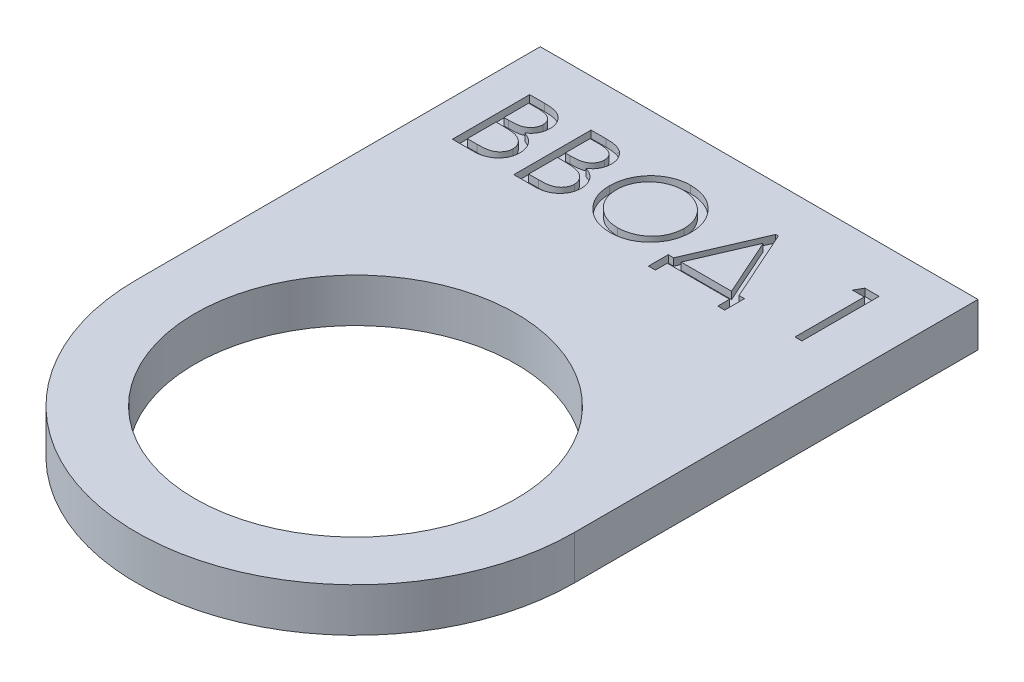
from build123d import *

# Parameters (mm, degrees)
SKETCH1_R           = 11
BOSS_EXTRUDE1_DEPTH = 1.5
CUT_EXTRUDE1_DEPTH  = 0.5


with BuildPart() as part:
    # Sketch1 → Boss-Extrude1 (new, symmetric)
    with BuildSketch(Plane(origin=(0, 0, 0), x_dir=(1, 0, 0), z_dir=(0, 1, 0))):
        with BuildLine():
            Line((15, 17.5), (-15, 17.5))
            Line((-15, 17.5), (-15, -10.16226942))
            ThreePointArc((-15, -10.16226942), (0, -25.16226942), (15, -10.16226942))
            Line((15, -10.16226942), (15, 17.5))
        make_face()
        with Locations(Location((0, -10.16226942, 0), (0, 0, 270))):
            Circle(SKETCH1_R, mode=Mode.SUBTRACT)
    extrude(amount=BOSS_EXTRUDE1_DEPTH, both=True)

    # Sketch2 → Cut-Extrude1 (cut)
    # profile 1 of 5: a face of its own
    with BuildSketch(Plane(origin=(0, 1.5, 0), x_dir=(1, 0, 0), z_dir=(0, 1, 0))):
        Polygon((10.45294972, 14.291666667), (11.431356838, 14.291666667), (11.431356838, 9), (10.956463675, 9), (10.956463675, 13.748931624), (10.142361111, 13.748931624), align=None)
    # profile 2 of 5: a face of its own
    with BuildSketch(Plane(origin=(0, 1.5, 0), x_dir=(1, 0, 0), z_dir=(0, 1, 0))):
        Polygon((2.204861111, 8.185897436), (1.729967949, 8.185897436), (1.729967949, 9.542735043), (2.103098291, 9.542735043), (4.211496728, 14.427350427), (4.393821782, 14.427350427), (6.580662393, 9.542735043), (6.953792735, 9.542735043), (6.953792735, 8.185897436), (6.478899573, 8.185897436), (6.478899573, 9), (2.204861111, 9), align=None)
        Polygon((2.612972423, 9.542735043), (6.067608173, 9.542735043), (4.307959402, 13.472263956), align=None, mode=Mode.SUBTRACT)
    # profile 3 of 5: a face of its own
    with BuildSketch(Plane(origin=(0, 1.5, 0), x_dir=(1, 0, 0), z_dir=(0, 1, 0))):
        with BuildLine():
            add(Edge.make_bspline(
                [(-1.628205128, 14.427350427), (-1.530221444, 14.424868667), (-1.337773405, 14.419994285), (-1.054933976, 14.38268183), (-0.784915201, 14.318130467), (-0.525517491, 14.232159053), (-0.279843586, 14.117474446), (-0.046044308, 13.978855234), (0.17532406, 13.81484916), (0.381277816, 13.626724019), (0.569747253, 13.42203713), (0.735793533, 13.20360029), (0.874952715, 12.972734244), (0.989231227, 12.73013275), (1.078885077, 12.476344465), (1.140750774, 12.210016389), (1.180269168, 11.932874132), (1.184889212, 11.74384542), (1.187232906, 11.647953392)],
                knots=[0, 0, 0, 0, 1.065120563, 2.091984664, 3.0946048, 4.079830382, 5.057816894, 6.036188127, 7.030412546, 8.04752943, 9.064399622, 10.05169764, 11.02544977, 11.989514704, 12.962713494, 13.945757189, 14.957906945, 16, 16, 16, 16], degree=3))
            add(Edge.make_bspline(
                [(1.187232906, 11.647953392), (1.184889556, 11.552767729), (1.180270541, 11.36514576), (1.140705841, 11.08976222), (1.078655758, 10.825041762), (0.990063784, 10.571426311), (0.876330025, 10.328648327), (0.73624423, 10.097346623), (0.571233114, 9.87744537), (0.383444185, 9.671353602), (0.178730705, 9.482369331), (-0.040843627, 9.317694364), (-0.270340671, 9.175992414), (-0.512713682, 9.062926621), (-0.764748261, 8.97255717), (-1.028700107, 8.910943074), (-1.303332397, 8.871199569), (-1.490613557, 8.86663586), (-1.585803953, 8.864316239)],
                knots=[0, 0, 0, 0, 1.043624062, 2.057103931, 3.04512605, 4.022047818, 4.998200453, 5.980619268, 6.982898556, 8.009068085, 9.034988726, 10.034168286, 11.015286542, 11.987931943, 12.962482838, 13.94673481, 14.956375938, 16, 16, 16, 16], degree=3))
            add(Edge.make_bspline(
                [(-1.585803953, 8.864316239), (-1.681695483, 8.866658765), (-1.870723214, 8.871276506), (-2.148213732, 8.910860296), (-2.414728892, 8.972759649), (-2.669506542, 9.061220344), (-2.912688757, 9.175546395), (-3.144751144, 9.314950635), (-3.364762236, 9.480363812), (-3.570897972, 9.668091848), (-3.759506878, 9.872458361), (-3.923940696, 10.091433961), (-4.063376284, 10.320722568), (-4.177318466, 10.560960491), (-4.267525446, 10.810986363), (-4.329067254, 11.07246799), (-4.368884706, 11.343914624), (-4.373473104, 11.528734244), (-4.375801282, 11.622512687)],
                knots=[0, 0, 0, 0, 1.053102029, 2.075944431, 3.073151272, 4.055350789, 5.033113405, 6.020478099, 7.024410459, 8.052272461, 9.079885166, 10.07527673, 11.055994387, 12.023226415, 12.992069828, 13.970394897, 14.97016774, 16, 16, 16, 16], degree=3))
            add(Edge.make_bspline(
                [(-4.375801282, 11.622512687), (-4.374992964, 11.685457318), (-4.373386525, 11.810552504), (-4.354046705, 11.996315102), (-4.32598318, 12.179090263), (-4.285763622, 12.358358244), (-4.233161935, 12.533680209), (-4.171095179, 12.706265291), (-4.095288508, 12.874364493), (-4.009592767, 13.038774144), (-3.913946938, 13.196931335), (-3.80830146, 13.346427848), (-3.696367033, 13.488518164), (-3.573655712, 13.619520182), (-3.444211801, 13.743244877), (-3.305935443, 13.85779089), (-3.159670384, 13.964191113), (-3.004787262, 14.060076629), (-2.845102489, 14.146798177), (-2.68049117, 14.221216928), (-2.513188973, 14.28508895), (-2.342412303, 14.336857817), (-2.168614659, 14.377727681), (-1.991416723, 14.405557846), (-1.810959662, 14.424946994), (-1.689385406, 14.426545836), (-1.628205128, 14.427350427)],
                knots=[0, 0, 0, 0, 1.037015668, 2.060948919, 3.074880161, 4.083647147, 5.086022904, 6.090072063, 7.104153813, 8.122640571, 9.144368836, 10.147691507, 11.138137339, 12.123020368, 13.103399296, 14.087645067, 15.080126199, 16.082011238, 17.087798457, 18.072939717, 19.057185487, 20.037253025, 21.01195951, 21.997135196, 22.992090687, 24, 24, 24, 24], degree=3))
        make_face()
        with BuildLine():
            add(Edge.make_bspline(
                [(-1.604884482, 13.884615385), (-1.655101844, 13.884003229), (-1.755056488, 13.88278477), (-1.903653347, 13.866734819), (-2.050295913, 13.843859868), (-2.195014473, 13.811230664), (-2.337203506, 13.766774537), (-2.478188384, 13.715610307), (-2.616683478, 13.653287943), (-2.752231572, 13.58287445), (-2.883638888, 13.504937391), (-3.007634282, 13.418801505), (-3.124538756, 13.326486786), (-3.234066076, 13.227777794), (-3.335894634, 13.122171848), (-3.432028647, 13.011269951), (-3.5186148, 12.891902211), (-3.597967993, 12.767305524), (-3.668978895, 12.637642181), (-3.732124133, 12.504277271), (-3.783776861, 12.366122911), (-3.82590212, 12.224677934), (-3.860826834, 12.080166359), (-3.882951934, 11.93149192), (-3.899178239, 11.779401692), (-3.900327053, 11.676619603), (-3.90090812, 11.624632746)],
                knots=[0, 0, 0, 0, 1.008559885, 2.007477868, 2.99961109, 3.989939068, 4.984837346, 5.991145699, 7.001802488, 8.033829008, 9.059044045, 10.069351652, 11.065060232, 12.050310815, 13.029377138, 14.011219647, 14.996725999, 15.989392538, 16.977580475, 17.965360261, 18.951710183, 19.937753436, 20.929683414, 21.935841486, 22.955955122, 24, 24, 24, 24], degree=3))
            add(Edge.make_bspline(
                [(-3.90090812, 11.624632746), (-3.89898065, 11.548187483), (-3.89518872, 11.397796003), (-3.861990965, 11.177408452), (-3.810855361, 10.965608305), (-3.735475772, 10.763554466), (-3.64120758, 10.569510134), (-3.524750258, 10.38519669), (-3.386775212, 10.21056432), (-3.230045833, 10.046832187), (-3.058712693, 9.897386745), (-2.876781065, 9.766208734), (-2.686200016, 9.655219428), (-2.486472555, 9.564799854), (-2.278664966, 9.493151084), (-2.061438192, 9.444046487), (-1.836239283, 9.411728834), (-1.682734602, 9.408625263), (-1.604884482, 9.407051282)],
                knots=[0, 0, 0, 0, 1.032063989, 2.030389145, 3.003944642, 3.970395727, 4.937377036, 5.913328081, 6.909231446, 7.93887556, 8.970685674, 9.976071282, 10.964166581, 11.944589148, 12.933237628, 13.927779006, 14.949070134, 16, 16, 16, 16], degree=3))
            add(Edge.make_bspline(
                [(-1.604884482, 9.407051282), (-1.552558212, 9.407770199), (-1.448779502, 9.409196028), (-1.294420795, 9.423557123), (-1.142842951, 9.446586259), (-0.994258576, 9.479743322), (-0.848836302, 9.521240884), (-0.705969159, 9.570540663), (-0.567178886, 9.632046768), (-0.430714608, 9.70000379), (-0.300091719, 9.777474029), (-0.175396569, 9.860686469), (-0.059772171, 9.952865217), (0.049673211, 10.050107624), (0.151919836, 10.154374394), (0.246276277, 10.265529968), (0.33242481, 10.384275961), (0.411747871, 10.508683658), (0.482509947, 10.638701802), (0.544164061, 10.772550244), (0.596470093, 10.909899397), (0.638695332, 11.050947368), (0.671784066, 11.195426271), (0.694583469, 11.343529556), (0.710531703, 11.494960942), (0.711733784, 11.597383201), (0.712339744, 11.649013421)],
                knots=[0, 0, 0, 0, 1.047197238, 2.076906641, 3.100256066, 4.114471768, 5.12198147, 6.126382909, 7.136867548, 8.15857795, 9.17633901, 10.174870724, 11.156907918, 12.133735059, 13.104061851, 14.077631395, 15.04955518, 16.038496417, 17.029181396, 18.010275684, 18.986308667, 19.968651475, 20.955262928, 21.950658345, 22.966943676, 24, 24, 24, 24], degree=3))
            add(Edge.make_bspline(
                [(0.712339744, 11.649013421), (0.711733299, 11.700290434), (0.710530304, 11.802007834), (0.694591087, 11.952383118), (0.671759979, 12.099420712), (0.638856837, 12.242543367), (0.596447676, 12.381787565), (0.544154926, 12.517022529), (0.482491438, 12.648752062), (0.41172186, 12.776650582), (0.332171746, 12.899379055), (0.245245926, 13.016706512), (0.149443555, 13.126429586), (0.047501826, 13.23125704), (-0.063125584, 13.328953135), (-0.181937552, 13.419550279), (-0.307491684, 13.505234872), (-0.44042929, 13.582531853), (-0.577625506, 13.653915276), (-0.718404942, 13.71507334), (-0.861172747, 13.767040711), (-1.00556587, 13.81136517), (-1.152799658, 13.843732073), (-1.301879257, 13.866755434), (-1.452598409, 13.882779184), (-1.553961373, 13.884001375), (-1.604884482, 13.884615385)],
                knots=[0, 0, 0, 0, 1.02996197, 2.043119294, 3.035359645, 4.018872909, 4.991431989, 5.957985074, 6.929999688, 7.912076566, 8.892894881, 9.867085534, 10.843653904, 11.817741046, 12.803660682, 13.806313499, 14.818574707, 15.856120519, 16.894564902, 17.924820532, 18.937903209, 19.946497019, 20.957711757, 21.963978472, 22.977135795, 24, 24, 24, 24], degree=3))
        make_face(mode=Mode.SUBTRACT)
    # profile 4 of 5: a face of its own
    with BuildSketch(Plane(origin=(0, 1.5, 0), x_dir=(1, 0, 0), z_dir=(0, 1, 0))):
        with BuildLine():
            Line((-8.310630342, 14.291666667), (-7.278161725, 14.291666667))
            add(Edge.make_bspline(
                [(-7.278161725, 14.291666667), (-7.22762105, 14.291400949), (-7.129660643, 14.290885921), (-6.98720982, 14.28289833), (-6.853786023, 14.272007068), (-6.729350558, 14.254725856), (-6.613960924, 14.233874002), (-6.507269377, 14.208622447), (-6.409615188, 14.178344115), (-6.293028075, 14.13019557), (-6.160100409, 14.058647447), (-6.016169506, 13.952922116), (-5.893094049, 13.823605178), (-5.786979022, 13.677732592), (-5.702613043, 13.517265413), (-5.64157851, 13.346028306), (-5.602937437, 13.166229958), (-5.598963495, 13.042793249), (-5.596955128, 12.980410323)],
                knots=[0, 0, 0, 0, 1.001505555, 1.941167018, 2.826882275, 3.653841531, 4.429895133, 5.150066043, 5.825578002, 6.45369114, 7.647487171, 8.808567382, 9.977351308, 11.170798116, 12.373658725, 13.556498008, 14.765093433, 16, 16, 16, 16], degree=3))
            add(Edge.make_bspline(
                [(-5.596955128, 12.980410323), (-5.59860797, 12.92197134), (-5.601855961, 12.807133228), (-5.632914657, 12.639169515), (-5.681538525, 12.479283743), (-5.749128604, 12.328059423), (-5.836973288, 12.188913365), (-5.941080508, 12.060723093), (-6.066684722, 11.948916138), (-6.160790572, 11.886409607), (-6.208592081, 11.854659121)],
                knots=[0, 0, 0, 0, 1.044552857, 2.05264487, 3.044412934, 4.028983338, 5.005914585, 5.980388656, 6.974128949, 8, 8, 8, 8], degree=3))
            add(Edge.make_bspline(
                [(-6.208592081, 11.854659121), (-6.148478101, 11.831579897), (-6.033465166, 11.787423623), (-5.875189885, 11.709355719), (-5.73882387, 11.624443957), (-5.623318661, 11.531716041), (-5.524534349, 11.431765815), (-5.438275735, 11.323127725), (-5.364674134, 11.204384603), (-5.301608166, 11.076774496), (-5.252397547, 10.941600431), (-5.215543501, 10.800130329), (-5.194426048, 10.652871478), (-5.191420924, 10.552654297), (-5.189903846, 10.502061632)],
                knots=[0, 0, 0, 0, 1.27268992, 2.434971085, 3.483601985, 4.442670788, 5.356604649, 6.2567628, 7.179492994, 8.113709626, 9.066344395, 10.018646069, 10.999752585, 12, 12, 12, 12], degree=3))
            add(Edge.make_bspline(
                [(-5.189903846, 10.502061632), (-5.191380744, 10.450404575), (-5.194286583, 10.348767869), (-5.21572535, 10.199459511), (-5.252024833, 10.05677358), (-5.302025257, 9.919787173), (-5.367282566, 9.788765303), (-5.446699845, 9.663559534), (-5.541392804, 9.545427868), (-5.647321189, 9.433057628), (-5.767158005, 9.332020378), (-5.896449682, 9.242038298), (-6.036824475, 9.168036514), (-6.185976894, 9.105873005), (-6.345580087, 9.058388312), (-6.514917362, 9.025167873), (-6.693842676, 9.002784067), (-6.816624085, 9.000943769), (-6.879590678, 9)],
                knots=[0, 0, 0, 0, 0.978564426, 1.925352924, 2.850884081, 3.763762016, 4.682927383, 5.618979971, 6.567305752, 7.547517671, 8.540179244, 9.531824382, 10.526200242, 11.540722885, 12.589160233, 13.674978461, 14.80764778, 16, 16, 16, 16], degree=3))
            Line((-6.879590678, 9), (-8.310630342, 9))
            Line((-8.310630342, 9), (-8.310630342, 14.291666667))
        make_face()
        with BuildLine():
            Line((-7.835737179, 13.748931624), (-7.835737179, 12.052884615))
            Line((-7.835737179, 12.052884615), (-7.516668336, 12.052884615))
            add(Edge.make_bspline(
                [(-7.516668336, 12.052884615), (-7.470027895, 12.053489261), (-7.379909059, 12.054657559), (-7.249401597, 12.058004186), (-7.1282602, 12.067375038), (-7.016693976, 12.076743196), (-6.914878615, 12.091975013), (-6.823039681, 12.11010596), (-6.73973585, 12.129281305), (-6.643670109, 12.161892315), (-6.534702675, 12.210088324), (-6.418538339, 12.284885029), (-6.316130271, 12.373973039), (-6.229653571, 12.476768898), (-6.158879086, 12.58995944), (-6.109721445, 12.711738653), (-6.076388051, 12.839071471), (-6.073377045, 12.926487163), (-6.071848291, 12.970870059)],
                knots=[0, 0, 0, 0, 1.156816544, 2.235205308, 3.236616184, 4.169592532, 5.011045266, 5.787822928, 6.49130361, 7.128639758, 8.301311294, 9.436451833, 10.541879658, 11.654887649, 12.756523258, 13.837046038, 14.901820046, 16, 16, 16, 16], degree=3))
            add(Edge.make_bspline(
                [(-6.071848291, 12.970870059), (-6.072643825, 13.000239975), (-6.074204352, 13.057852274), (-6.086984941, 13.141837607), (-6.108707345, 13.220825185), (-6.136608479, 13.295897471), (-6.17559852, 13.364707054), (-6.221505185, 13.429633076), (-6.276970455, 13.488464493), (-6.340103535, 13.543451711), (-6.412688, 13.592202366), (-6.494680548, 13.63489971), (-6.587190489, 13.669281599), (-6.688658734, 13.699392924), (-6.800647164, 13.720541893), (-6.921863453, 13.738160705), (-7.053300468, 13.747130446), (-7.144234135, 13.74831784), (-7.191239316, 13.748931624)],
                knots=[0, 0, 0, 0, 0.91205012, 1.789085906, 2.630437955, 3.453916878, 4.269457761, 5.079663411, 5.91843418, 6.774407191, 7.675494373, 8.627863946, 9.638891023, 10.736472738, 11.911756761, 13.175263542, 14.539845004, 16, 16, 16, 16], degree=3))
            Line((-7.191239316, 13.748931624), (-7.835737179, 13.748931624))
        make_face(mode=Mode.SUBTRACT)
        with BuildLine():
            Line((-7.835737179, 11.510149573), (-7.835737179, 9.542735043))
            Line((-7.835737179, 9.542735043), (-7.159438435, 9.542735043))
            add(Edge.make_bspline(
                [(-7.159438435, 9.542735043), (-7.111028868, 9.543315232), (-7.017725811, 9.544433471), (-6.883013237, 9.548084048), (-6.758155449, 9.556387845), (-6.643722196, 9.569459547), (-6.538477821, 9.583638869), (-6.443684865, 9.602705924), (-6.358574918, 9.624551377), (-6.259886381, 9.658318518), (-6.148756077, 9.710776277), (-6.028996806, 9.789870406), (-5.922519072, 9.884097311), (-5.832099215, 9.993152384), (-5.757996245, 10.111733081), (-5.704088592, 10.237440931), (-5.670840511, 10.368198812), (-5.666815565, 10.457350865), (-5.664797009, 10.502061632)],
                knots=[0, 0, 0, 0, 1.160039823, 2.235823828, 3.228722157, 4.157150951, 4.99529583, 5.772374946, 6.472645482, 7.099169577, 8.269452708, 9.405989375, 10.527446681, 11.663510218, 12.788923519, 13.866172445, 14.929861265, 16, 16, 16, 16], degree=3))
            add(Edge.make_bspline(
                [(-5.664797009, 10.502061632), (-5.665214452, 10.530021802), (-5.666042606, 10.585491141), (-5.678531869, 10.667006724), (-5.696695696, 10.745967271), (-5.720177744, 10.822587188), (-5.754376224, 10.895481221), (-5.794300406, 10.966091044), (-5.841111096, 11.034509995), (-5.91405168, 11.121009473), (-6.020145038, 11.220669719), (-6.170892186, 11.318244276), (-6.342300304, 11.396935603), (-6.466620442, 11.430347907), (-6.530841012, 11.447607839)],
                knots=[0, 0, 0, 0, 0.723448775, 1.435228256, 2.130040452, 2.821711965, 3.505591119, 4.210454504, 4.921174351, 5.648778258, 7.137944449, 8.670945889, 10.280296675, 12, 12, 12, 12], degree=3))
            add(Edge.make_bspline(
                [(-6.530841012, 11.447607839), (-6.556587383, 11.452831597), (-6.612410827, 11.464157782), (-6.703438954, 11.476113476), (-6.807361042, 11.486764936), (-6.924417058, 11.49464371), (-7.054755104, 11.502787651), (-7.19865354, 11.505954821), (-7.355524719, 11.509733464), (-7.464370329, 11.510007322), (-7.520908454, 11.510149573)],
                knots=[0, 0, 0, 0, 0.634451884, 1.375622551, 2.216452059, 3.157844607, 4.20941857, 5.370758133, 6.634282058, 8, 8, 8, 8], degree=3))
            Line((-7.520908454, 11.510149573), (-7.835737179, 11.510149573))
        make_face(mode=Mode.SUBTRACT)
    # profile 5 of 5: a face of its own
    with BuildSketch(Plane(origin=(0, 1.5, 0), x_dir=(1, 0, 0), z_dir=(0, 1, 0))):
        with BuildLine():
            Line((-12.516826923, 14.291666667), (-11.484358307, 14.291666667))
            add(Edge.make_bspline(
                [(-11.484358307, 14.291666667), (-11.433817631, 14.291400949), (-11.335857224, 14.290885921), (-11.193406401, 14.28289833), (-11.059982604, 14.272007068), (-10.935547139, 14.254725856), (-10.820157505, 14.233874002), (-10.713465959, 14.208622447), (-10.61581177, 14.178344115), (-10.499224656, 14.13019557), (-10.36629699, 14.058647447), (-10.222366087, 13.952922116), (-10.09929063, 13.823605178), (-9.993175603, 13.677732592), (-9.908809624, 13.517265413), (-9.847775091, 13.346028306), (-9.809134018, 13.166229958), (-9.805160076, 13.042793249), (-9.803151709, 12.980410323)],
                knots=[0, 0, 0, 0, 1.001505555, 1.941167018, 2.826882275, 3.653841531, 4.429895133, 5.150066043, 5.825578002, 6.45369114, 7.647487171, 8.808567382, 9.977351308, 11.170798116, 12.373658725, 13.556498008, 14.765093433, 16, 16, 16, 16], degree=3))
            add(Edge.make_bspline(
                [(-9.803151709, 12.980410323), (-9.804804552, 12.92197134), (-9.808052542, 12.807133228), (-9.839111238, 12.639169515), (-9.887735106, 12.479283743), (-9.955325185, 12.328059423), (-10.04316987, 12.188913365), (-10.147277089, 12.060723093), (-10.272881303, 11.948916138), (-10.366987154, 11.886409607), (-10.414788662, 11.854659121)],
                knots=[0, 0, 0, 0, 1.044552857, 2.05264487, 3.044412934, 4.028983338, 5.005914585, 5.980388656, 6.974128949, 8, 8, 8, 8], degree=3))
            add(Edge.make_bspline(
                [(-10.414788662, 11.854659121), (-10.354674682, 11.831579897), (-10.239661747, 11.787423623), (-10.081386467, 11.709355719), (-9.945020451, 11.624443957), (-9.829515242, 11.531716041), (-9.730730931, 11.431765815), (-9.644472317, 11.323127725), (-9.570870715, 11.204384603), (-9.507804747, 11.076774496), (-9.458594128, 10.941600431), (-9.421740082, 10.800130329), (-9.400622629, 10.652871478), (-9.397617505, 10.552654297), (-9.396100427, 10.502061632)],
                knots=[0, 0, 0, 0, 1.27268992, 2.434971085, 3.483601985, 4.442670788, 5.356604649, 6.2567628, 7.179492994, 8.113709626, 9.066344395, 10.018646069, 10.999752585, 12, 12, 12, 12], degree=3))
            add(Edge.make_bspline(
                [(-9.396100427, 10.502061632), (-9.397577326, 10.450404575), (-9.400483164, 10.348767869), (-9.421921931, 10.199459511), (-9.458221414, 10.05677358), (-9.508221838, 9.919787173), (-9.573479147, 9.788765303), (-9.652896426, 9.663559534), (-9.747589385, 9.545427868), (-9.853517771, 9.433057628), (-9.973354586, 9.332020378), (-10.102646263, 9.242038298), (-10.243021056, 9.168036514), (-10.392173476, 9.105873005), (-10.551776668, 9.058388312), (-10.721113943, 9.025167873), (-10.900039257, 9.002784067), (-11.022820666, 9.000943769), (-11.08578726, 9)],
                knots=[0, 0, 0, 0, 0.978564426, 1.925352924, 2.850884081, 3.763762016, 4.682927383, 5.618979971, 6.567305752, 7.547517671, 8.540179244, 9.531824382, 10.526200242, 11.540722885, 12.589160233, 13.674978461, 14.80764778, 16, 16, 16, 16], degree=3))
            Line((-11.08578726, 9), (-12.516826923, 9))
            Line((-12.516826923, 9), (-12.516826923, 14.291666667))
        make_face()
        with BuildLine():
            Line((-12.041933761, 13.748931624), (-12.041933761, 12.052884615))
            Line((-12.041933761, 12.052884615), (-11.722864917, 12.052884615))
            add(Edge.make_bspline(
                [(-11.722864917, 12.052884615), (-11.676224477, 12.053489261), (-11.586105641, 12.054657559), (-11.455598178, 12.058004186), (-11.334456781, 12.067375038), (-11.222890558, 12.076743196), (-11.121075196, 12.091975013), (-11.029236262, 12.11010596), (-10.945932431, 12.129281305), (-10.84986669, 12.161892315), (-10.740899256, 12.210088324), (-10.62473492, 12.284885029), (-10.522326853, 12.373973039), (-10.435850152, 12.476768898), (-10.365075667, 12.58995944), (-10.315918026, 12.711738653), (-10.282584632, 12.839071471), (-10.279573627, 12.926487163), (-10.278044872, 12.970870059)],
                knots=[0, 0, 0, 0, 1.156816544, 2.235205308, 3.236616184, 4.169592532, 5.011045266, 5.787822928, 6.49130361, 7.128639758, 8.301311294, 9.436451833, 10.541879658, 11.654887649, 12.756523258, 13.837046038, 14.901820046, 16, 16, 16, 16], degree=3))
            add(Edge.make_bspline(
                [(-10.278044872, 12.970870059), (-10.278840406, 13.000239975), (-10.280400934, 13.057852274), (-10.293181522, 13.141837607), (-10.314903926, 13.220825185), (-10.34280506, 13.295897471), (-10.381795101, 13.364707054), (-10.427701766, 13.429633076), (-10.483167036, 13.488464493), (-10.546300116, 13.543451711), (-10.618884581, 13.592202366), (-10.70087713, 13.63489971), (-10.79338707, 13.669281599), (-10.894855315, 13.699392924), (-11.006843745, 13.720541893), (-11.128060034, 13.738160705), (-11.25949705, 13.747130446), (-11.350430717, 13.74831784), (-11.397435897, 13.748931624)],
                knots=[0, 0, 0, 0, 0.91205012, 1.789085906, 2.630437955, 3.453916878, 4.269457761, 5.079663411, 5.91843418, 6.774407191, 7.675494373, 8.627863946, 9.638891023, 10.736472738, 11.911756761, 13.175263542, 14.539845004, 16, 16, 16, 16], degree=3))
            Line((-11.397435897, 13.748931624), (-12.041933761, 13.748931624))
        make_face(mode=Mode.SUBTRACT)
        with BuildLine():
            Line((-12.041933761, 11.510149573), (-12.041933761, 9.542735043))
            Line((-12.041933761, 9.542735043), (-11.365635016, 9.542735043))
            add(Edge.make_bspline(
                [(-11.365635016, 9.542735043), (-11.317225449, 9.543315232), (-11.223922392, 9.544433471), (-11.089209818, 9.548084048), (-10.96435203, 9.556387845), (-10.849918777, 9.569459547), (-10.744674402, 9.583638869), (-10.649881446, 9.602705924), (-10.564771499, 9.624551377), (-10.466082962, 9.658318518), (-10.354952658, 9.710776277), (-10.235193387, 9.789870406), (-10.128715653, 9.884097311), (-10.038295797, 9.993152384), (-9.964192826, 10.111733081), (-9.910285173, 10.237440931), (-9.877037092, 10.368198812), (-9.873012146, 10.457350865), (-9.87099359, 10.502061632)],
                knots=[0, 0, 0, 0, 1.160039823, 2.235823828, 3.228722157, 4.157150951, 4.99529583, 5.772374946, 6.472645482, 7.099169577, 8.269452708, 9.405989375, 10.527446681, 11.663510218, 12.788923519, 13.866172445, 14.929861265, 16, 16, 16, 16], degree=3))
            add(Edge.make_bspline(
                [(-9.87099359, 10.502061632), (-9.871411033, 10.530021802), (-9.872239187, 10.585491141), (-9.88472845, 10.667006724), (-9.902892277, 10.745967271), (-9.926374326, 10.822587188), (-9.960572806, 10.895481221), (-10.000496987, 10.966091044), (-10.047307677, 11.034509995), (-10.120248261, 11.121009473), (-10.226341619, 11.220669719), (-10.377088768, 11.318244276), (-10.548496885, 11.396935603), (-10.672817023, 11.430347907), (-10.737037593, 11.447607839)],
                knots=[0, 0, 0, 0, 0.723448775, 1.435228256, 2.130040452, 2.821711965, 3.505591119, 4.210454504, 4.921174351, 5.648778258, 7.137944449, 8.670945889, 10.280296675, 12, 12, 12, 12], degree=3))
            add(Edge.make_bspline(
                [(-10.737037593, 11.447607839), (-10.762783965, 11.452831597), (-10.818607408, 11.464157782), (-10.909635535, 11.476113476), (-11.013557623, 11.486764936), (-11.13061364, 11.49464371), (-11.260951685, 11.502787651), (-11.404850122, 11.505954821), (-11.5617213, 11.509733464), (-11.67056691, 11.510007322), (-11.727105035, 11.510149573)],
                knots=[0, 0, 0, 0, 0.634451884, 1.375622551, 2.216452059, 3.157844607, 4.20941857, 5.370758133, 6.634282058, 8, 8, 8, 8], degree=3))
            Line((-11.727105035, 11.510149573), (-12.041933761, 11.510149573))
        make_face(mode=Mode.SUBTRACT)
    extrude(amount=-CUT_EXTRUDE1_DEPTH, mode=Mode.SUBTRACT)


solid = part.part
